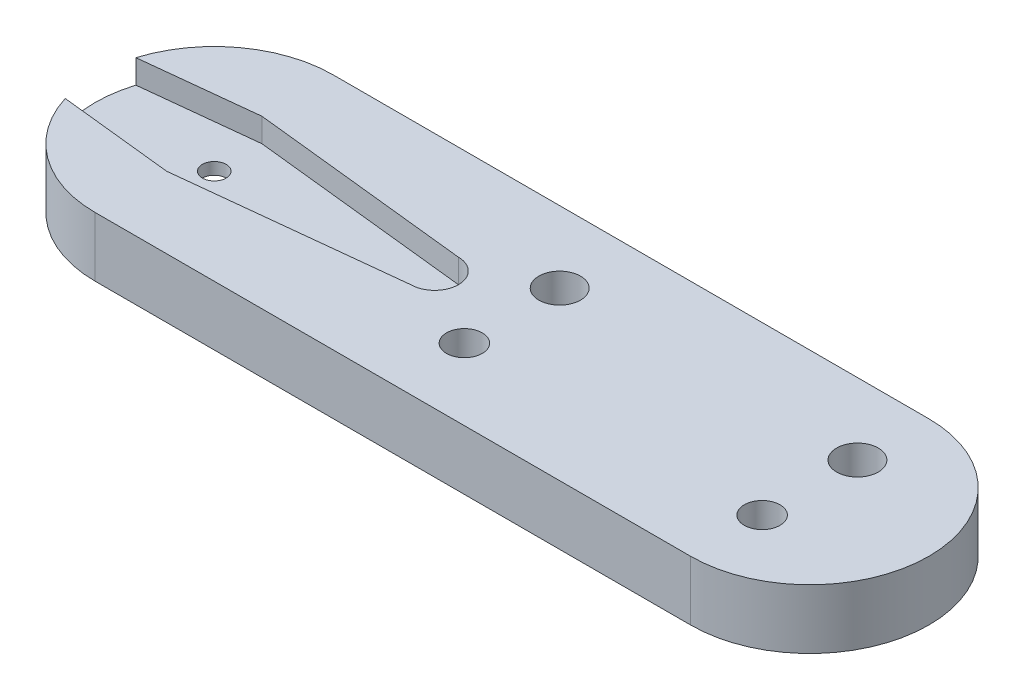
from build123d import *

# Parameters (mm, degrees)
BOSS_EXTRUDE1_DEPTH = 5
CUT_EXTRUDE4_DEPTH  = 37.742346142
CUT_EXTRUDE5_DEPTH  = 2
SKETCH7_R           = 4
CUT_EXTRUDE6_DEPTH  = 2
CUT_EXTRUDE10_DEPTH = 37.742346142
SKETCH12_R          = 1.75
SKETCH12_R_2        = 1.5
CUT_EXTRUDE11_DEPTH = 37.742346142


with BuildPart() as part:
    # Sketch1 → Boss-Extrude1 (new body)
    with BuildSketch(Plane(origin=(0, 0, 0), x_dir=(1, 0, 0), z_dir=(0, 1, 0))):
        with BuildLine():
            Line((-25, 10), (25, 10))
            ThreePointArc((25, 10), (35, 0), (25, -10))
            Line((25, -10), (-25, -10))
            ThreePointArc((-25, -10), (-35, 0), (-25, 10))
        make_face()
    extrude(amount=BOSS_EXTRUDE1_DEPTH)

    # Sketch5 → Cut-Extrude4 (cut, through all)
    with BuildSketch(Plane(origin=(0, 5, 0), x_dir=(1, 0, 0), z_dir=(0, 1, 0))):
        with BuildLine():
            ThreePointArc((-24, 0), (-24.292893219, 0.707106781), (-25, 1))
            Line((-25, 1), (-25, -1))
            ThreePointArc((-25, -1), (-24.292893219, -0.707106781), (-24, 0))
        make_face()
        with BuildLine():
            Line((-25, -1), (-25, 1))
            ThreePointArc((-25, 1), (-26, 0), (-25, -1))
        make_face()
    extrude(amount=-CUT_EXTRUDE4_DEPTH, mode=Mode.SUBTRACT)

    # Sketch6 → Cut-Extrude5 (cut)
    with BuildSketch(Plane(origin=(0, 5, 0), x_dir=(1, 0, 0), z_dir=(0, 1, 0))):
        with BuildLine():
            Line((-43.5, 2), (-25, 4))
            Line((-25, 4), (-6.5, 2))
            ThreePointArc((-6.5, 2), (-4.5, 0), (-6.5, -2))
            Line((-6.5, -2), (-25, -4))
            Line((-25, -4), (-43.5, -2))
            ThreePointArc((-43.5, -2), (-45.5, 0), (-43.5, 2))
        make_face()
    extrude(amount=-CUT_EXTRUDE5_DEPTH, mode=Mode.SUBTRACT)

    # Sketch7 → Cut-Extrude6 (cut)
    with BuildSketch(Plane.XZ):
        with Locations(Location((-25, 0, 0), (0, 0, 270))):
            Circle(SKETCH7_R)
    extrude(amount=-CUT_EXTRUDE6_DEPTH, mode=Mode.SUBTRACT)

    # Sketch11 → Cut-Extrude10 (cut, through all)
    with BuildSketch(Plane(origin=(0, 5, 0), x_dir=(1, 0, 0), z_dir=(0, 1, 0))):
        with BuildLine():
            ThreePointArc((26.75, 4), (26.237436867, 5.237436867), (25, 5.75))
            Line((25, 5.75), (25, 2.25))
            ThreePointArc((25, 2.25), (26.237436867, 2.762563133), (26.75, 4))
        make_face()
        with BuildLine():
            Line((25, 2.25), (25, 5.75))
            ThreePointArc((25, 5.75), (23.25, 4), (25, 2.25))
        make_face()
        with BuildLine():
            ThreePointArc((26.5, -4), (26.060660172, -2.939339828), (25, -2.5))
            Line((25, -2.5), (25, -5.5))
            ThreePointArc((25, -5.5), (26.060660172, -5.060660172), (26.5, -4))
        make_face()
        with BuildLine():
            Line((25, -5.5), (25, -2.5))
            ThreePointArc((25, -2.5), (23.5, -4), (25, -5.5))
        make_face()
    extrude(amount=-CUT_EXTRUDE10_DEPTH, mode=Mode.SUBTRACT)

    # Sketch12 → Cut-Extrude11 (cut, through all)
    with BuildSketch(Plane(origin=(0, 5, 0), x_dir=(1, 0, 0), z_dir=(0, 1, 0))):
        with Locations(Location((0, 4, 0), (0, 0, 270))):
            Circle(SKETCH12_R)
        with Locations(Location((0, -4, 0), (0, 0, 270))):
            Circle(SKETCH12_R_2)
    extrude(amount=-CUT_EXTRUDE11_DEPTH, mode=Mode.SUBTRACT)


solid = part.part
